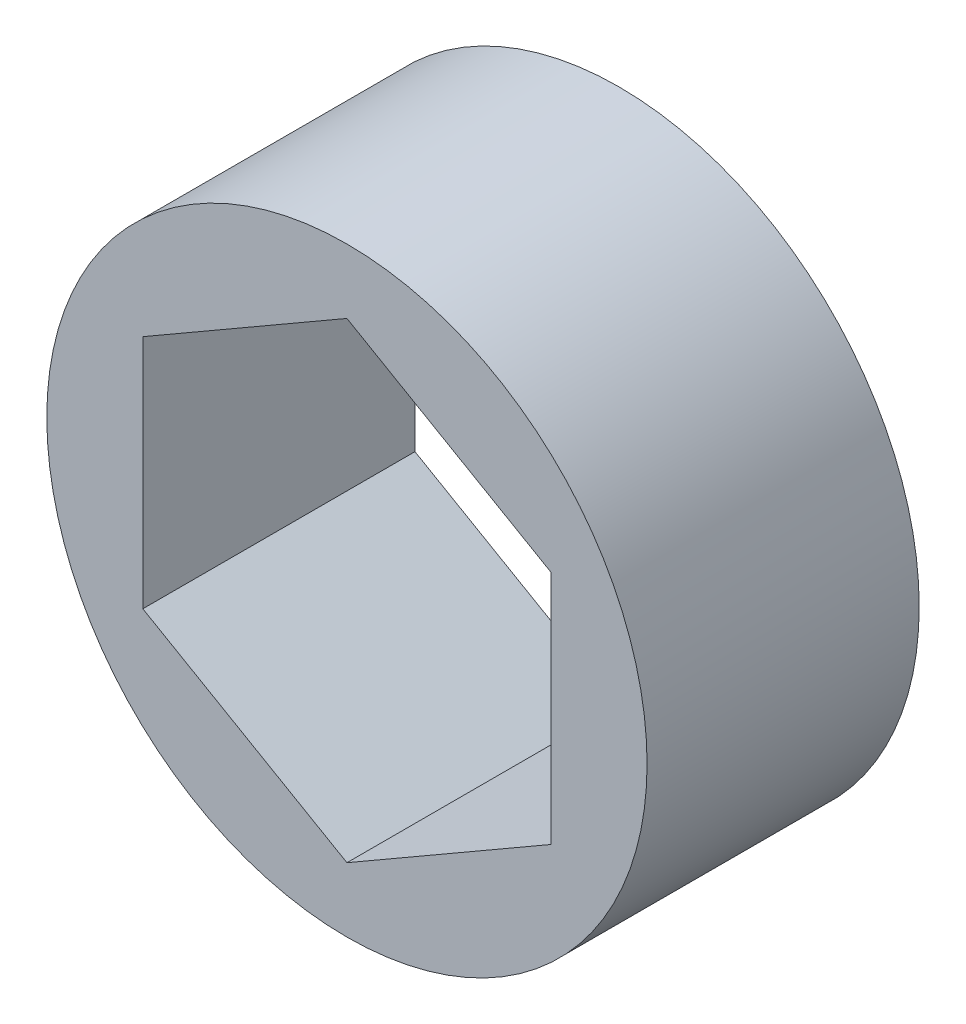
from build123d import *

# Parameters (mm, degrees)
SKETCH1_R           = 9.525
BOSS_EXTRUDE1_DEPTH = 4.318


with BuildPart() as part:
    # Sketch1 → Boss-Extrude1 (new, symmetric)
    with BuildSketch(Plane.XY):
        Circle(SKETCH1_R)
        Polygon((0, 7.478995387), (-6.477, 3.739497694), (-6.477, -3.739497694), (0, -7.478995387), (6.477, -3.739497694), (6.477, 3.739497694), align=None, mode=Mode.SUBTRACT)
    extrude(amount=BOSS_EXTRUDE1_DEPTH, both=True)


solid = part.part
